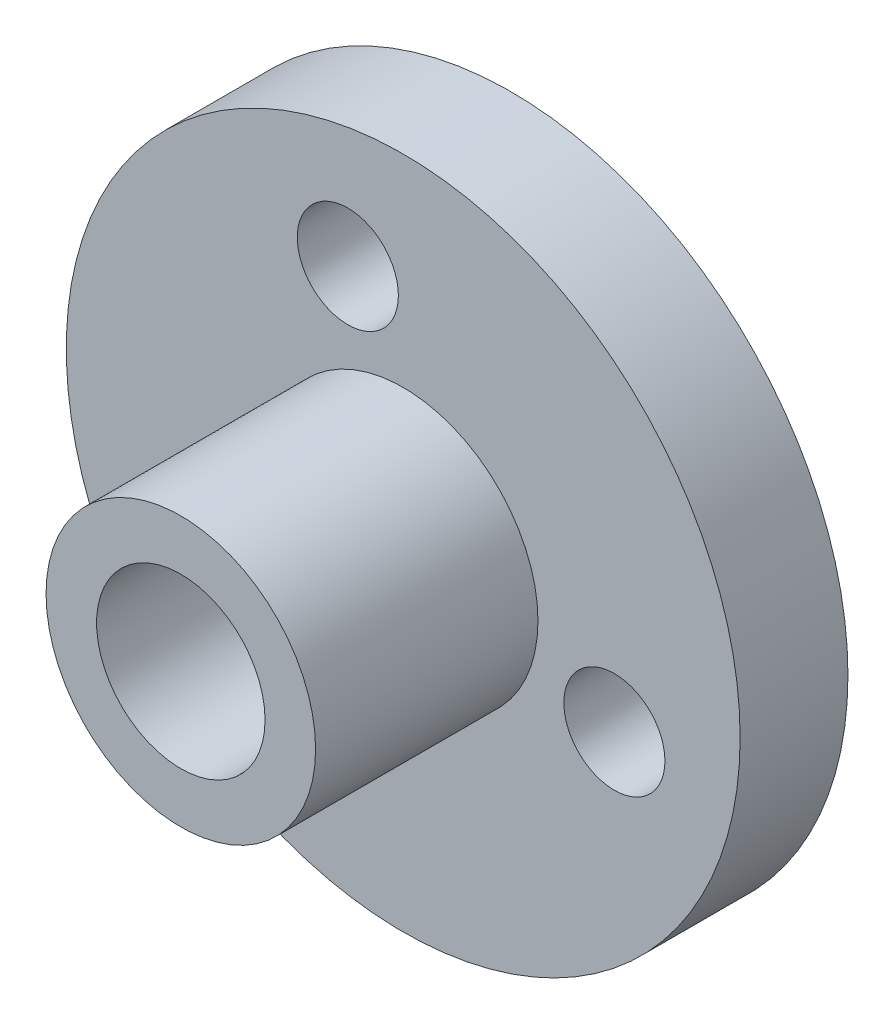
from build123d import *

# Parameters (mm, degrees)
ESQUISSE1_R             = 10
BOSS_EXTRU_1_DEPTH      = 3.2
ESQUISSE2_R             = 4
BOSS_EXTRU_2_DEPTH      = 6.6
ESQUISSE3_R             = 1.5
ENL_V_MAT_EXTRU_1_DEPTH = 16.60640894
ESQUISSE4_R             = 2.5
ENL_V_MAT_EXTRU_2_DEPTH = 18.205812971


with BuildPart() as part:
    # Esquisse1 → Boss.-Extru.1 (new body)
    with BuildSketch(Plane.XY):
        Circle(ESQUISSE1_R)
    extrude(amount=BOSS_EXTRU_1_DEPTH)

    # Esquisse2 → Boss.-Extru.2 (add)
    with BuildSketch(Plane.XY.offset(3.2)):
        Circle(ESQUISSE2_R)
    extrude(amount=BOSS_EXTRU_2_DEPTH)

    # Esquisse3 → Enlèv. mat.-Extru.1 (cut, through all)
    with BuildSketch(Plane.XY.offset(3.2)):
        with Locations((-1.643280046, 6.288849711)):
            Circle(ESQUISSE3_R)
        with Locations((6.267943633, -1.72130259)):
            Circle(ESQUISSE3_R)
        with Locations((-4.624663588, -4.567547121)):
            Circle(ESQUISSE3_R)
    extrude(amount=-ENL_V_MAT_EXTRU_1_DEPTH, mode=Mode.SUBTRACT)

    # Esquisse4 → Enlèv. mat.-Extru.2 (cut, through all)
    with BuildSketch(Plane.XY.offset(9.8)):
        Circle(ESQUISSE4_R)
    extrude(amount=-ENL_V_MAT_EXTRU_2_DEPTH, mode=Mode.SUBTRACT)


solid = part.part
